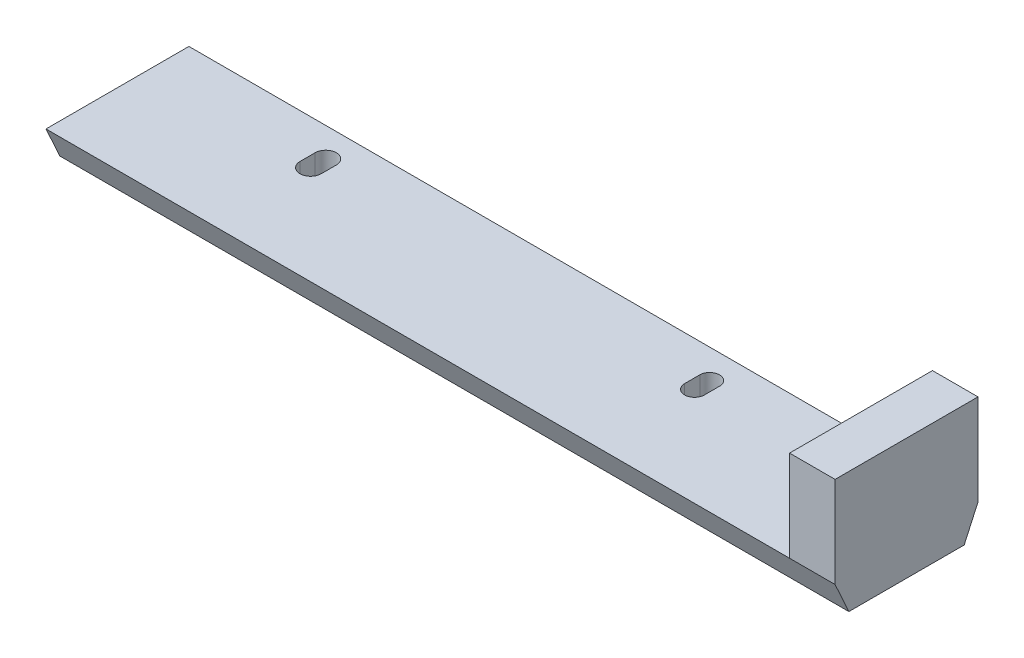
from build123d import *

# Parameters (mm, degrees)
SKETCH_1_W               = 52
SKETCH_1_H               = 10
EXTRUDE_1_DEPTH          = 2
SKETCH_5_R               = 0.6
CUT_EXTRUDE_1_DEPTH      = 53.990565198
SKETCH_6_W               = 3
SKETCH_6_H               = 10
EXTRUDE_2_DEPTH          = 6
CUT_EXTRUDE_2_DEPTH      = 54.291650378
CUT_EXTRUDE_3_DEPTH      = 54.553711356
CUT_EXTRUDE_3_DEPTH_BACK = 54.553711356


with BuildPart() as part:
    # 草图1 → 凸台-拉伸1 (new body)
    with BuildSketch(Plane(origin=(0, 0, 0), x_dir=(1, 0, 0), z_dir=(0, 1, 0))):
        with Locations((26, -5)):
            Rectangle(SKETCH_1_W, SKETCH_1_H)
    extrude(amount=EXTRUDE_1_DEPTH)

    # 草图5 → 切除-拉伸1 (cut, through all)
    with BuildSketch(Plane(origin=(0, 2, 0), x_dir=(1, 0, 0), z_dir=(0, 1, 0))):
        with Locations(Location((36.226363192, -2.7, 0), (0, 0, 270))):
            Circle(SKETCH_5_R)
        with Locations(Location((10.926363192, -2.7, 0), (0, 0, 270))):
            Circle(SKETCH_5_R)
    extrude(amount=-CUT_EXTRUDE_1_DEPTH, mode=Mode.SUBTRACT)

    # 草图6 → 凸台-拉伸2 (add)
    with BuildSketch(Plane(origin=(0, 2, 0), x_dir=(1, 0, 0), z_dir=(0, 1, 0))):
        with Locations((50.5, -5)):
            Rectangle(SKETCH_6_W, SKETCH_6_H)
    extrude(amount=EXTRUDE_2_DEPTH)

    # 草图7 → 切除-拉伸2 (cut, through all)
    with BuildSketch(Plane(origin=(0, 2, 0), x_dir=(1, 0, 0), z_dir=(0, 1, 0))):
        with BuildLine():
            Line((11.626363192, -2.2), (11.626363192, -3.2))
            ThreePointArc((11.626363192, -3.2), (10.926363192, -3.9), (10.226363192, -3.2))
            Line((10.226363192, -3.2), (10.226363192, -2.2))
            ThreePointArc((10.226363192, -2.2), (10.926363192, -1.5), (11.626363192, -2.2))
        make_face()
        with BuildLine():
            Line((36.876363192, -2.2), (36.876363192, -3.2))
            ThreePointArc((36.876363192, -3.2), (36.226363192, -3.85), (35.576363192, -3.2))
            Line((35.576363192, -3.2), (35.576363192, -2.2))
            ThreePointArc((35.576363192, -2.2), (36.226363192, -1.55), (36.876363192, -2.2))
        make_face()
    extrude(amount=-CUT_EXTRUDE_2_DEPTH, mode=Mode.SUBTRACT)

    # 草图9 → 切除-拉伸3 (cut, two sides: drawn at the far end of the back side and taken through both)
    with BuildSketch(Plane(origin=(52, 0, 0), x_dir=(0, 0, -1), z_dir=(1, 0, 0)).offset(-CUT_EXTRUDE_3_DEPTH_BACK)):
        Polygon((-0.290909091, 2), (-1.2, 0), (0, 0), (0, 8), (-0.290909091, 8), align=None)
        Polygon((-9.709090909, 2), (-8.8, 0), (-10, 0), (-10, 8), (-9.709090909, 8), align=None)
    extrude(amount=CUT_EXTRUDE_3_DEPTH + CUT_EXTRUDE_3_DEPTH_BACK, mode=Mode.SUBTRACT)


solid = part.part
